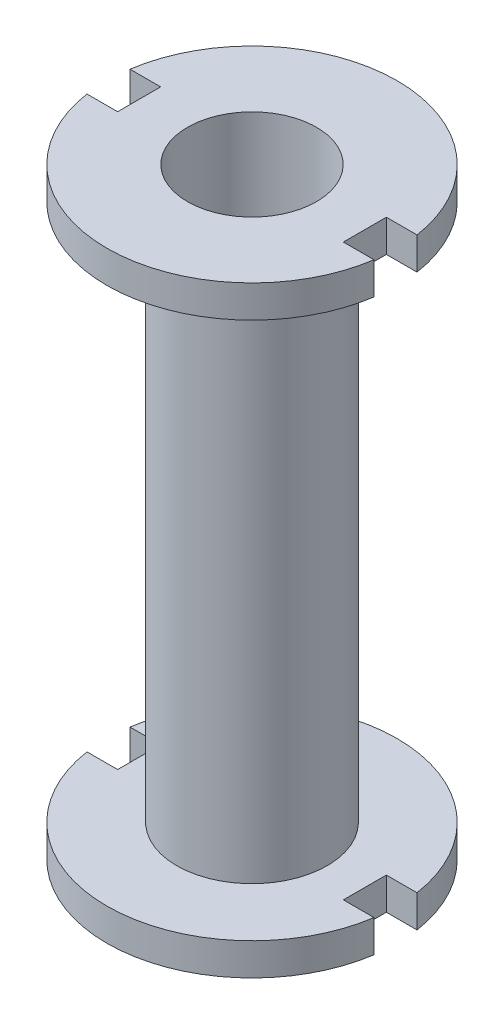
from build123d import *

# Parameters (mm, degrees)
SKETCH_1_R          = 6.75
SKETCH_1_R_2        = 3
EXTRUDE_1_DEPTH     = 14
SKETCH_2_R          = 11.31533916
SKETCH_2_R_2        = 3.5
CUT_EXTRUDE_1_DEPTH = 12.5
SKETCH_4_W          = 3
SKETCH_4_H          = 2
CUT_EXTRUDE_2_DEPTH = 30.582511726


with BuildPart() as part:
    # 草图1 → 凸台-拉伸1 (new, symmetric)
    with BuildSketch(Plane(origin=(0, 0, 0), x_dir=(1, 0, 0), z_dir=(0, 1, 0))):
        with Locations(Location((0, 0, 0), (0, 0, 270))):
            Circle(SKETCH_1_R)
        with Locations(Location((0, 0, 0), (0, 0, 270))):
            Circle(SKETCH_1_R_2, mode=Mode.SUBTRACT)
    extrude(amount=EXTRUDE_1_DEPTH, both=True)

    # 草图2 → 切除-拉伸1 (cut, symmetric)
    with BuildSketch(Plane(origin=(0, 0, 0), x_dir=(1, 0, 0), z_dir=(0, 1, 0))):
        Circle(SKETCH_2_R)
        with Locations(Location((0, 0, 0), (0, 0, 270))):
            Circle(SKETCH_2_R_2, mode=Mode.SUBTRACT)
    extrude(amount=CUT_EXTRUDE_1_DEPTH, both=True, mode=Mode.SUBTRACT)

    # 草图4 → 切除-拉伸2 (cut, through all)
    with BuildSketch(Plane(origin=(0, 14, 0), x_dir=(1, 0, 0), z_dir=(0, 1, 0))):
        with Locations((-6.75, 0)):
            Rectangle(SKETCH_4_W, SKETCH_4_H)
        with Locations((6.75, 0)):
            Rectangle(SKETCH_4_W, SKETCH_4_H)
    extrude(amount=-CUT_EXTRUDE_2_DEPTH, mode=Mode.SUBTRACT)


solid = part.part
